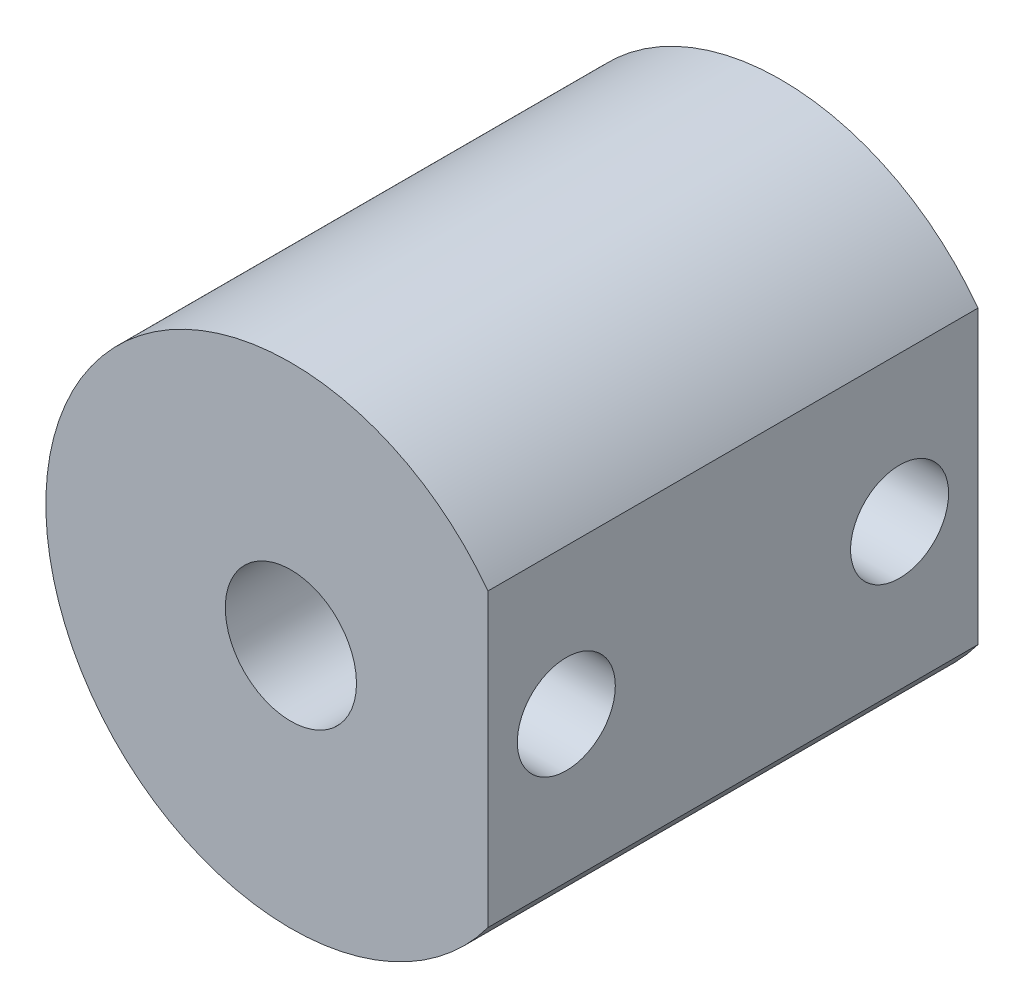
from build123d import *

# Parameters (mm, degrees)
SKETCH1_R           = 6.35
BOSS_EXTRUDE1_DEPTH = 12.7
SKETCH2_R           = 1.7
CUT_EXTRUDE1_DEPTH  = 6.35
CUT_EXTRUDE2_DEPTH  = 6.35
SKETCH4_W           = 3.114007597
SKETCH4_H           = 7.898709862
CUT_EXTRUDE3_DEPTH  = 14.224
SKETCH5_R           = 1.27
CUT_EXTRUDE4_DEPTH  = 3.81


with BuildPart() as part:
    # Sketch1 → Boss-Extrude1 (new body)
    with BuildSketch(Plane.XY):
        Circle(SKETCH1_R)
    extrude(amount=BOSS_EXTRUDE1_DEPTH)

    # Sketch2 → Cut-Extrude1 (cut)
    with BuildSketch(Plane.XY.offset(12.7)):
        Circle(SKETCH2_R)
    extrude(amount=-CUT_EXTRUDE1_DEPTH, mode=Mode.SUBTRACT)

    # Sketch3 → Cut-Extrude2 (cut)
    with BuildSketch(Plane(origin=(0, 0, 0), x_dir=(-1, 0, 0), z_dir=(0, 0, -1))):
        Polygon((-2.646216495, -1.536512804), (0.007550874, -3.05994711), (2.653767369, -1.523434307), (2.646216495, 1.536512804), (-0.007550874, 3.05994711), (-2.653767369, 1.523434307), align=None)
    extrude(amount=-CUT_EXTRUDE2_DEPTH, mode=Mode.SUBTRACT)

    # Sketch4 → Cut-Extrude3 (cut)
    with BuildSketch(Plane(origin=(0, 0, 0), x_dir=(-1, 0, 0), z_dir=(0, 0, -1))):
        with Locations((-6.6621984, 0.173181196)):
            Rectangle(SKETCH4_W, SKETCH4_H)
    extrude(amount=-CUT_EXTRUDE3_DEPTH, mode=Mode.SUBTRACT)

    # Sketch5 → Cut-Extrude4 (cut)
    with BuildSketch(Plane(origin=(5.105194602, 0, 0), x_dir=(0, 0, -1), z_dir=(1, 0, 0))):
        with Locations((-10.668, 0)):
            Circle(SKETCH5_R)
        with Locations((-2.032, 0)):
            Circle(SKETCH5_R)
    extrude(amount=-CUT_EXTRUDE4_DEPTH, mode=Mode.SUBTRACT)


solid = part.part
